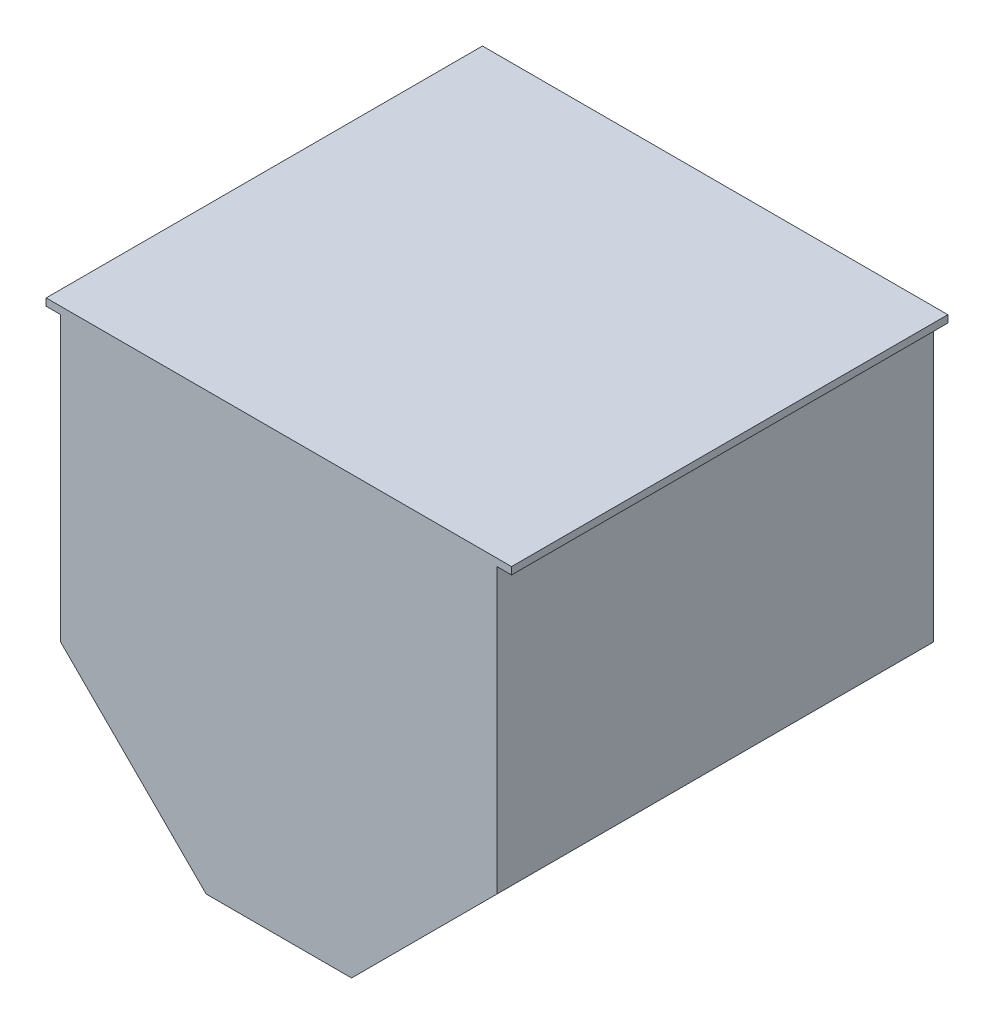
from build123d import *

# Parameters (mm, degrees)
BOSS_EXTRUDE1_DEPTH = 300


with BuildPart() as part:
    # Sketch1 → Boss-Extrude1 (new body)
    with BuildSketch(Plane.XY):
        Polygon((154.545454545, 126.859504132), (-145.454545455, 126.859504132), (-155.454545455, 126.859504132), (-155.454545455, 121.859504132), (-145.454545455, 121.859504132), (-145.454545455, -73.140495868), (-45.454545455, -173.140495868), (54.545454545, -173.140495868), (154.545454545, -73.140495868), (154.545454545, 121.859504132), (164.545454545, 121.859504132), (164.545454545, 126.859504132), align=None)
    extrude(amount=BOSS_EXTRUDE1_DEPTH)


solid = part.part
